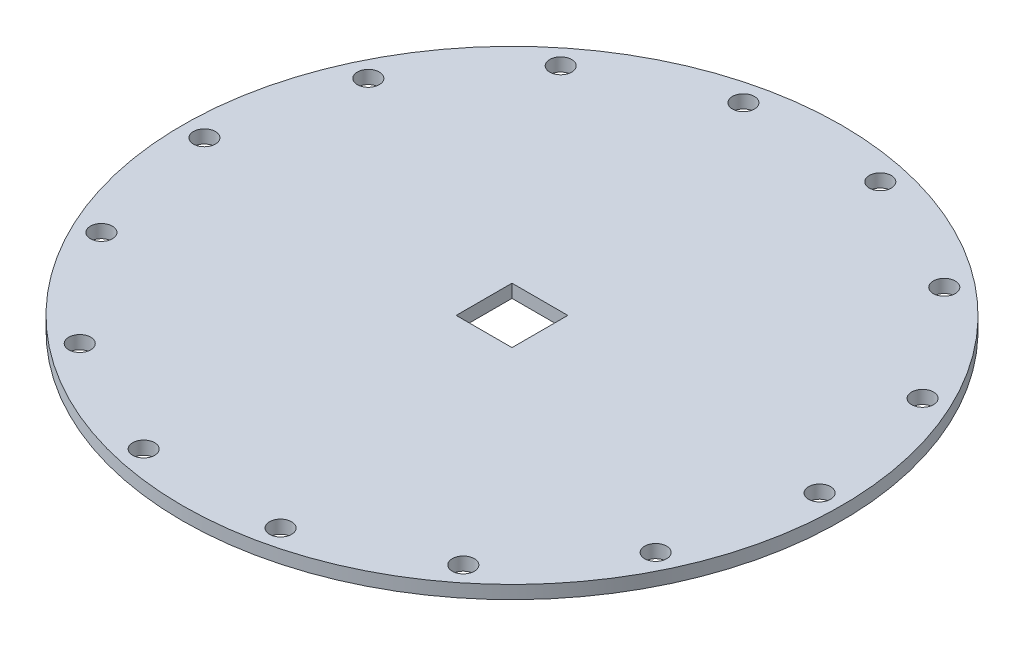
from build123d import *

# Parameters (mm, degrees)
CROQUIS1_R              = 150
SALIENTE_EXTRUIR1_DEPTH = 6
CROQUIS2_R              = 5
CORTAR_EXTRUIR1_DEPTH   = 213.216870206
CROQUIS4_W              = 25.4
CROQUIS4_H              = 25.4
CORTAR_EXTRUIR2_DEPTH   = 213.216870206


with BuildPart() as part:
    # Croquis1 → Saliente-Extruir1 (new body)
    with BuildSketch(Plane(origin=(0, 0, 0), x_dir=(1, 0, 0), z_dir=(0, 1, 0))):
        with Locations(Location((0, 0, 0), (0, 0, 270))):
            Circle(CROQUIS1_R)
    extrude(amount=SALIENTE_EXTRUIR1_DEPTH)

    # Croquis2 → Cortar-Extruir1 (cut, through all)
    with BuildSketch(Plane.XZ):
        with Locations(Location((140, 0, 0), (0, 0, 270))):
            Circle(CROQUIS2_R)
        with Locations(Location((126.135641506, -60.743723476, 0), (0, 0, 270))):
            Circle(CROQUIS2_R)
        with Locations(Location((87.28857226, -109.456407546, 0), (0, 0, 270))):
            Circle(CROQUIS2_R)
        with Locations(Location((31.152930754, -136.489907705, 0), (0, 0, 270))):
            Circle(CROQUIS2_R)
        with Locations(Location((-31.152930754, -136.489907705, 0), (0, 0, 270))):
            Circle(CROQUIS2_R)
        with Locations(Location((-87.28857226, -109.456407546, 0), (0, 0, 270))):
            Circle(CROQUIS2_R)
        with Locations(Location((-126.135641506, -60.743723476, 0), (0, 0, 270))):
            Circle(CROQUIS2_R)
        with Locations(Location((-140, 0, 0), (0, 0, 270))):
            Circle(CROQUIS2_R)
        with Locations(Location((-126.135641506, 60.743723476, 0), (0, 0, 270))):
            Circle(CROQUIS2_R)
        with Locations(Location((-87.28857226, 109.456407546, 0), (0, 0, 270))):
            Circle(CROQUIS2_R)
        with Locations(Location((-31.152930754, 136.489907705, 0), (0, 0, 270))):
            Circle(CROQUIS2_R)
        with Locations(Location((31.152930754, 136.489907705, 0), (0, 0, 270))):
            Circle(CROQUIS2_R)
        with Locations(Location((87.28857226, 109.456407546, 0), (0, 0, 270))):
            Circle(CROQUIS2_R)
        with Locations(Location((126.135641506, 60.743723476, 0), (0, 0, 270))):
            Circle(CROQUIS2_R)
    extrude(amount=-CORTAR_EXTRUIR1_DEPTH, mode=Mode.SUBTRACT)

    # Croquis4 → Cortar-Extruir2 (cut, through all)
    with BuildSketch(Plane.XZ):
        Rectangle(CROQUIS4_W, CROQUIS4_H)
    extrude(amount=-CORTAR_EXTRUIR2_DEPTH, mode=Mode.SUBTRACT)


solid = part.part
